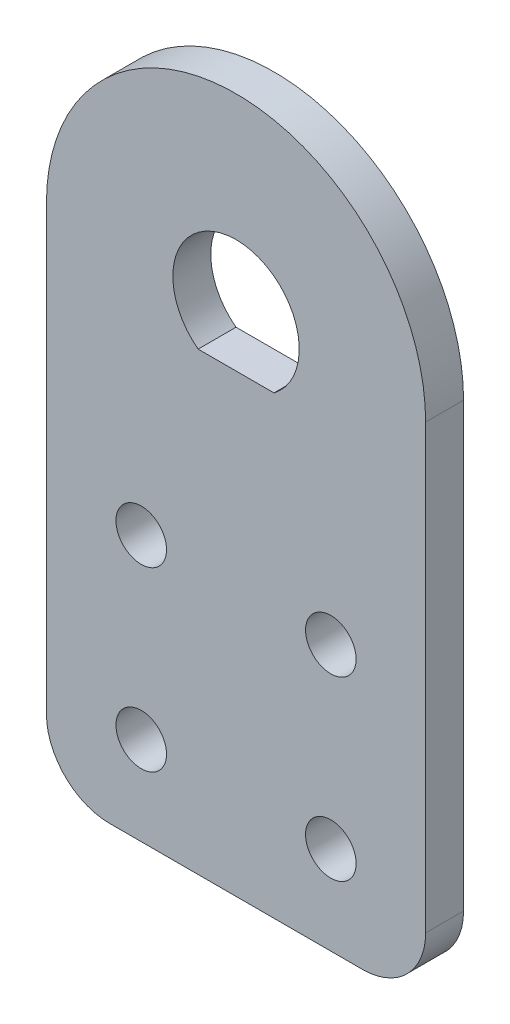
from build123d import *

# Parameters (mm, degrees)
SKETCH_1_R      = 2
EXTRUDE_1_DEPTH = 3
FILLET_1_R      = 5


with BuildPart() as part:
    # 草图1 → 凸台-拉伸1 (new body)
    with BuildSketch(Plane.XY):
        with BuildLine():
            Line((-15, 9.366750419), (-15, -30.633249581))
            Line((-15, -30.633249581), (15, -30.633249581))
            Line((15, -30.633249581), (15, 9.366750419))
            ThreePointArc((15, 9.366750419), (0, 24.366750419), (-15, 9.366750419))
        make_face()
        with Locations((-7.5, -9.633249581)):
            Circle(SKETCH_1_R, mode=Mode.SUBTRACT)
        with Locations((-7.5, -23.633249581)):
            Circle(SKETCH_1_R, mode=Mode.SUBTRACT)
        with Locations(Location((7.5, -23.633249581, 0), (0, 0, 180))):
            Circle(SKETCH_1_R, mode=Mode.SUBTRACT)
        with Locations(Location((7.5, -9.633249581, 0), (0, 0, 180))):
            Circle(SKETCH_1_R, mode=Mode.SUBTRACT)
        with BuildLine():
            Line((3, 5.366750419), (-3, 5.366750419))
            ThreePointArc((-3, 5.366750419), (0, 14.366750419), (3, 5.366750419))
        make_face(mode=Mode.SUBTRACT)
    extrude(amount=EXTRUDE_1_DEPTH)

    # 圆角1
    fillet_1_edges = [part.edges().sort_by_distance(p)[0] for p in [
        (15, -30.633249581, 1.5),
        (-15, -30.633249581, 1.5),
    ]]
    fillet(fillet_1_edges, radius=FILLET_1_R)


solid = part.part
